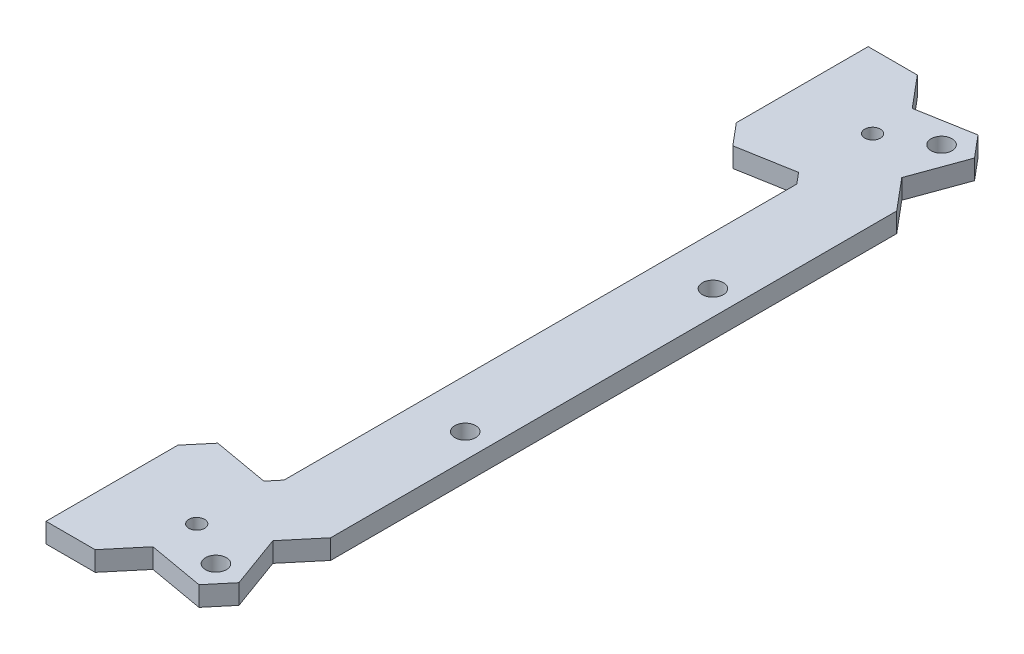
from build123d import *

# Parameters (mm, degrees)
BOSS_EXTRUDE1_DEPTH         = 6.35
BOSS_EXTRUDE3_DEPTH         = 6.35
F_1_4_CLEARANCE_HOLE1_D     = 6.7564
TAP_DRILL_FOR_1_4_20_TAP1_D = 5.08
BOSS_EXTRUDE4_DEPTH         = 6.35


with BuildPart() as part:
    # Sketch2 → Boss-Extrude1 (new body)
    with BuildSketch(Plane(origin=(0, 0, 0), x_dir=(1, 0, 0), z_dir=(0, 1, 0))):
        Polygon((2.766393585, 15.625659676), (9.035920728, -1.599724579), (3.144492336, -8.62085553), (-14.907891591, -5.437733178), (-33.036934837, 9.774340324), (-39.306461979, 26.999724579), (-33.415033588, 34.02085553), (-15.362649661, 30.837733178), align=None)
    extrude(amount=-BOSS_EXTRUDE1_DEPTH)

    # Sketch7 → Boss-Extrude3 (add)
    with BuildSketch(Plane.XZ.offset(6.35)):
        Polygon((2.766393585, -15.625659676), (11.284005931, -25.77655479), (11.284005931, -208.646188628), (2.766393585, -218.797083741), (9.035920728, -236.022467996), (3.144492336, -243.043598948), (-14.907891591, -239.860476595), (-33.036934837, -224.648403094), (-39.306461979, -207.423018839), (-33.415033588, -200.401887887), (-15.362649661, -203.58501024), (-12.381779272, -200.032547244), (-12.381779272, -34.390196174), (-15.362649661, -30.837733178), align=None)
    extrude(amount=-BOSS_EXTRUDE3_DEPTH)

    # 1/4 Clearance Hole1 (through all)
    with Locations(Plane(origin=(0, 0, 0), x_dir=(1, 0, 0), z_dir=(0, 1, 0))):
        with Locations((0, 0), (3.333805931, 77.211371709), (3.333805931, 157.211371709), (0, 234.422743417)):
            Hole(F_1_4_CLEARANCE_HOLE1_D / 2)

    # Tap Drill for 1/4-20 Tap1 (through all)
    with Locations(Plane(origin=(0, 0, 0), x_dir=(1, 0, 0), z_dir=(0, 1, 0))):
        with Locations((-14.247913361, 8.043291), (-14.247913361, 226.379452417)):
            Hole(TAP_DRILL_FOR_1_4_20_TAP1_D / 2)

    # Sketch10 → Boss-Extrude4 (add)
    with BuildSketch(Plane.XZ.offset(6.35)):
        Polygon((-14.907891591, -239.860476595), (-23.425503936, -250.011371709), (-39.306461979, -250.011371709), (-39.306461979, -207.423018839), (-33.036934837, -224.648403094), align=None)
        Polygon((-14.907891591, 5.437733178), (-23.425503936, 15.588628291), (-39.306461979, 15.588628291), (-39.306461979, -26.999724579), (-33.036934837, -9.774340324), align=None)
    extrude(amount=-BOSS_EXTRUDE4_DEPTH)


solid = part.part
